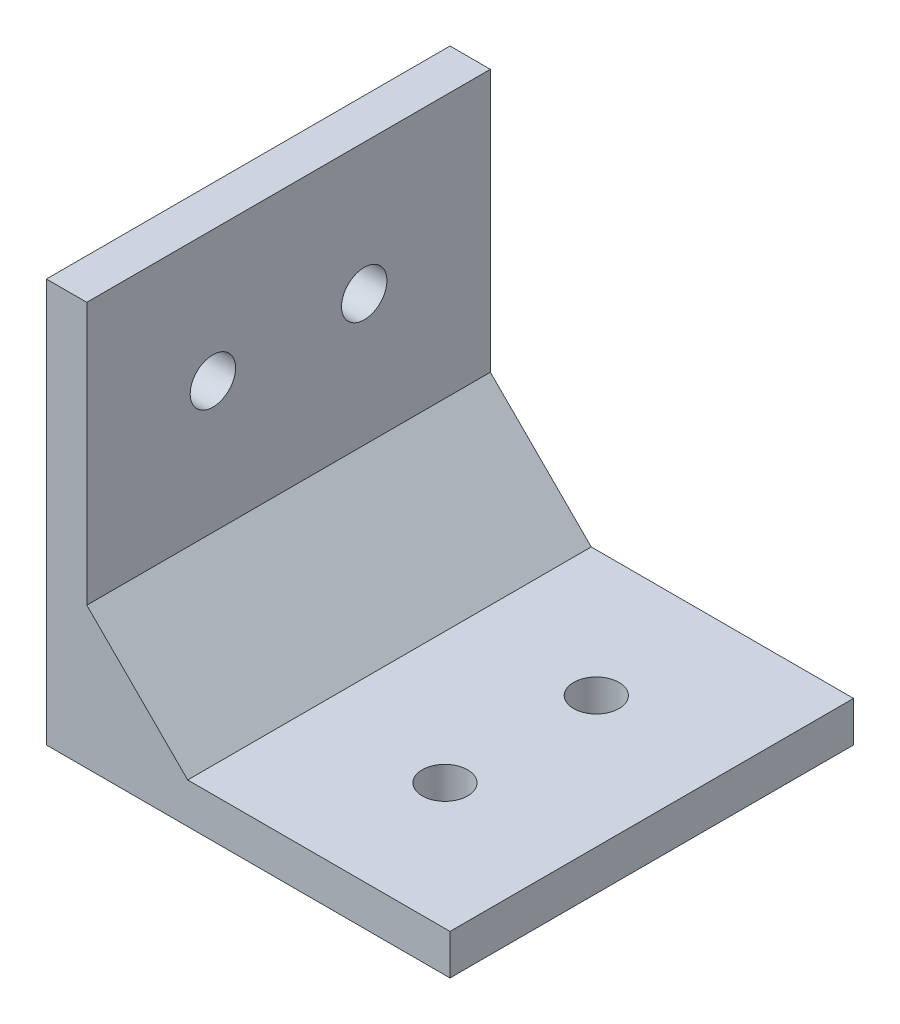
from build123d import *

# Parameters (mm, degrees)
SCHIZZO1_W                   = 40
SCHIZZO1_H                   = 40
ESTRUSIONE_ESTRUSIONE1_DEPTH = 4
SCHIZZO2_W                   = 4
SCHIZZO2_H                   = 40
ESTRUSIONE_ESTRUSIONE2_DEPTH = 36
SMUSSO1_SIZE                 = 10
FORO_PER_VITE_M4_1_D         = 4.5
FORO_PER_VITE_M4_1_DEPTH     = 9
FORO_PER_VITE_M4_1_TIP       = 1.351936393
FORO_PER_VITE_M4_3_D         = 4.5
FORO_PER_VITE_M4_3_DEPTH     = 9
FORO_PER_VITE_M4_3_TIP       = 1.351936393


with BuildPart() as part:
    # Schizzo1 → Estrusione-Estrusione1 (new body)
    with BuildSketch(Plane(origin=(0, 0, 0), x_dir=(1, 0, 0), z_dir=(0, 1, 0))):
        with Locations((-20, 20)):
            Rectangle(SCHIZZO1_W, SCHIZZO1_H)
    extrude(amount=ESTRUSIONE_ESTRUSIONE1_DEPTH)

    # Schizzo2 → Estrusione-Estrusione2 (add)
    with BuildSketch(Plane(origin=(0, 4, 0), x_dir=(1, 0, 0), z_dir=(0, 1, 0))):
        with Locations((-38, 20)):
            Rectangle(SCHIZZO2_W, SCHIZZO2_H)
    extrude(amount=ESTRUSIONE_ESTRUSIONE2_DEPTH)

    # Smusso1
    smusso1_edges = [part.edges().sort_by_distance(p)[0] for p in [
        (-36, 4, -20),
    ]]
    chamfer(smusso1_edges, length=SMUSSO1_SIZE)

    # Foro per Vite M4-1
    with Locations(Plane(origin=(0, 0, 0), x_dir=(-1, 0, 0), z_dir=(0, -1, 0))):
        with Locations((13, 27.5), (13, 12.5)):
            Hole(FORO_PER_VITE_M4_1_D / 2, depth=FORO_PER_VITE_M4_1_DEPTH)
            with Locations((0, 0, -(FORO_PER_VITE_M4_1_DEPTH + FORO_PER_VITE_M4_1_TIP / 2))):  # 118° drill point
                Cone(0, FORO_PER_VITE_M4_1_D / 2, FORO_PER_VITE_M4_1_TIP, mode=Mode.SUBTRACT)

    # Foro per Vite M4-3
    with Locations(Plane.ZY.offset(40)):
        with Locations((-27.5, 27), (-12.5, 27)):
            Hole(FORO_PER_VITE_M4_3_D / 2, depth=FORO_PER_VITE_M4_3_DEPTH)
            with Locations((0, 0, -(FORO_PER_VITE_M4_3_DEPTH + FORO_PER_VITE_M4_3_TIP / 2))):  # 118° drill point
                Cone(0, FORO_PER_VITE_M4_3_D / 2, FORO_PER_VITE_M4_3_TIP, mode=Mode.SUBTRACT)


solid = part.part
